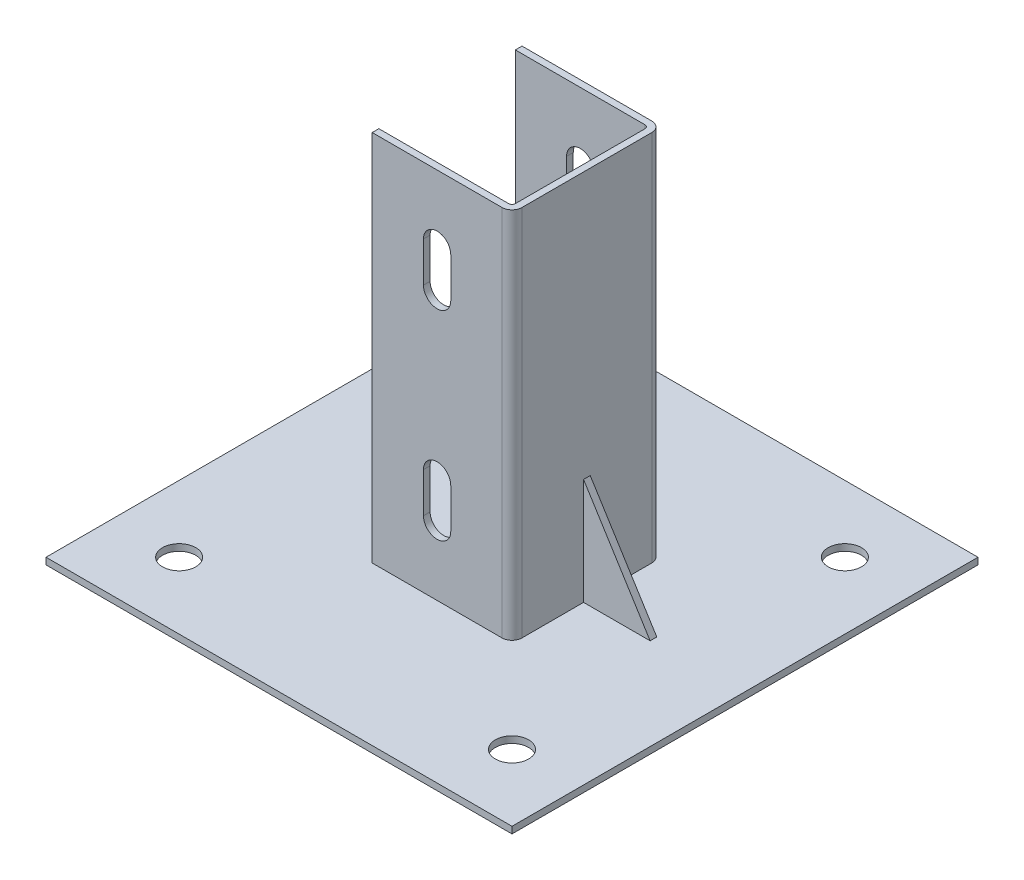
from build123d import *

# Parameters (mm, degrees)
EXTRUDE_1_DEPTH          = 112
SKETCH_3_W               = 140
SKETCH_3_H               = 140
EXTRUDE_2_DEPTH          = 2
EXTRUDE_3_DEPTH          = 1
CUT_EXTRUDE_1_DEPTH      = 2
PATTERN_CIRCULAR_2_COUNT = 4
SKETCH_7_R               = 5
CUT_EXTRUDE_2_DEPTH      = 150.479095528
SKETCH_8_W               = 10.222107434
SKETCH_8_H               = 48.162502517
CUT_EXTRUDE_3_DEPTH      = 112


with BuildPart() as part:
    # 草图1 → 凸台-拉伸1 (new body)
    with BuildSketch(Plane(origin=(0, 0, 0), x_dir=(1, 0, 0), z_dir=(0, 1, 0))):
        with BuildLine():
            Line((-19.5, -22.5), (19.5, -22.5))
            ThreePointArc((19.5, -22.5), (21.621320344, -21.621320344), (22.5, -19.5))
            Line((22.5, -19.5), (22.5, 19.5))
            ThreePointArc((22.5, 19.5), (21.621320344, 21.621320344), (19.5, 22.5))
            Line((19.5, 22.5), (-19.5, 22.5))
            ThreePointArc((-19.5, 22.5), (-21.621320344, 21.621320344), (-22.5, 19.5))
            Line((-22.5, 19.5), (-22.5, -19.5))
            ThreePointArc((-22.5, -19.5), (-21.621320344, -21.621320344), (-19.5, -22.5))
        make_face()
        with BuildLine():
            Line((-19.5, -20.5), (19.5, -20.5))
            ThreePointArc((19.5, -20.5), (20.207106781, -20.207106781), (20.5, -19.5))
            Line((20.5, -19.5), (20.5, 19.5))
            ThreePointArc((20.5, 19.5), (20.207106781, 20.207106781), (19.5, 20.5))
            Line((19.5, 20.5), (-19.5, 20.5))
            ThreePointArc((-19.5, 20.5), (-20.207106781, 20.207106781), (-20.5, 19.5))
            Line((-20.5, 19.5), (-20.5, -19.5))
            ThreePointArc((-20.5, -19.5), (-20.207106781, -20.207106781), (-19.5, -20.5))
        make_face(mode=Mode.SUBTRACT)
    extrude(amount=EXTRUDE_1_DEPTH)

    # 草图3 → 凸台-拉伸2 (add)
    with BuildSketch(Plane.XZ):
        Rectangle(SKETCH_3_W, SKETCH_3_H)
    extrude(amount=EXTRUDE_2_DEPTH)

    # 草图4 → 凸台-拉伸3 (add, symmetric)
    with BuildSketch(Plane.XY):
        Polygon((22.5, 32), (42.5, 0), (22.5, 0), align=None)
    extrude(amount=EXTRUDE_3_DEPTH, both=True)

    # 草图6 → 切除-拉伸1 (cut)
    with BuildSketch(Plane.XY.offset(22.5)):
        with BuildLine():
            Line((-4.1, 80), (-4.1, 92))
            ThreePointArc((-4.1, 92), (0, 96.1), (4.1, 92))
            Line((4.1, 92), (4.1, 80))
            ThreePointArc((4.1, 80), (0, 75.9), (-4.1, 80))
        make_face()
        with BuildLine():
            Line((-4.1, 20), (-4.1, 32))
            ThreePointArc((-4.1, 32), (0, 36.1), (4.1, 32))
            Line((4.1, 32), (4.1, 20))
            ThreePointArc((4.1, 20), (0, 15.9), (-4.1, 20))
        make_face()
    cut_extrude_1 = extrude(amount=-CUT_EXTRUDE_1_DEPTH, mode=Mode.SUBTRACT)

    # 阵列(圆周)2: 切除-拉伸1 ×4 about axis, 1 skipped
    pattern_circular_2_axis = Axis((0, 0, 0), (0, 1, 0))
    add([cut_extrude_1.rotate(pattern_circular_2_axis, i * 360 / PATTERN_CIRCULAR_2_COUNT) for i in range(1, PATTERN_CIRCULAR_2_COUNT) if i not in (1,)], mode=Mode.SUBTRACT)

    # 草图7 → 切除-拉伸2 (cut, through all)
    with BuildSketch(Plane(origin=(0, 0, 0), x_dir=(1, 0, 0), z_dir=(0, 1, 0))):
        with Locations(Location((50, 50, 0), (0, 0, 270))):
            Circle(SKETCH_7_R)
        with Locations(Location((50, -50, 0), (0, 0, 270))):
            Circle(SKETCH_7_R)
        with Locations(Location((-50, -50, 0), (0, 0, 270))):
            Circle(SKETCH_7_R)
        with Locations(Location((-50, 50, 0), (0, 0, 270))):
            Circle(SKETCH_7_R)
    extrude(amount=-CUT_EXTRUDE_2_DEPTH, mode=Mode.SUBTRACT)

    # 草图8 → 切除-拉伸3 (cut)
    with BuildSketch(Plane(origin=(0, 112, 0), x_dir=(1, 0, 0), z_dir=(0, 1, 0))):
        with Locations((-24.611053717, 1.581251259)):
            Rectangle(SKETCH_8_W, SKETCH_8_H)
    extrude(amount=-CUT_EXTRUDE_3_DEPTH, mode=Mode.SUBTRACT)


solid = part.part
